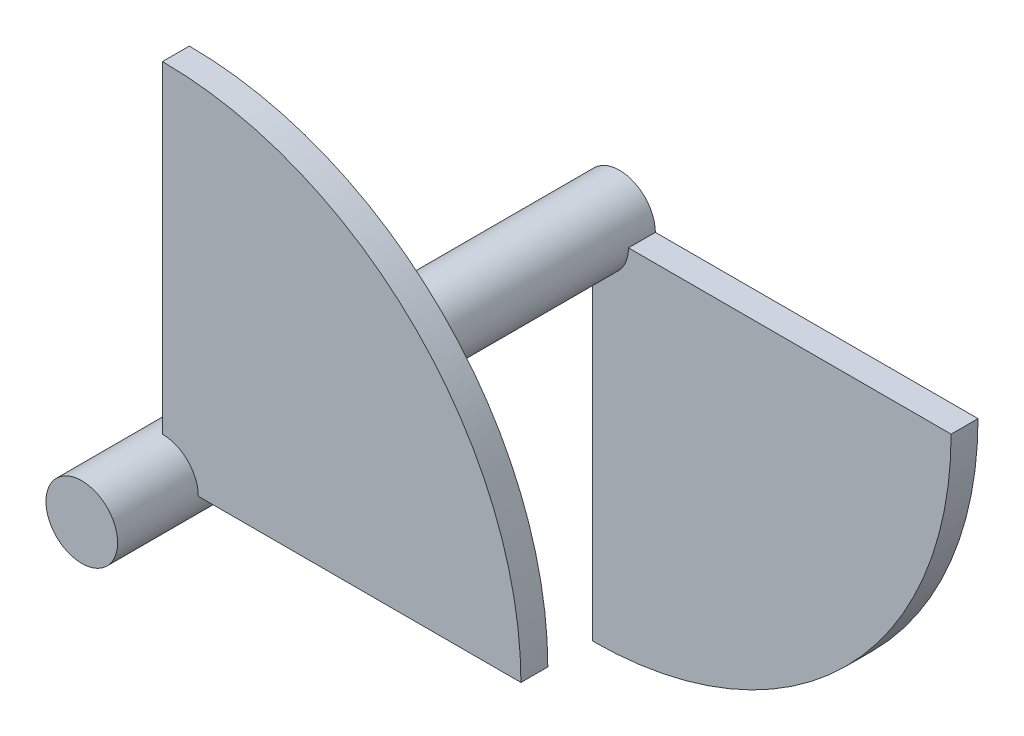
from build123d import *

# Parameters (mm, degrees)
SKETCH_1_R      = 4
EXTRUDE_1_DEPTH = 60
SKETCH_2_W      = 40
SKETCH_2_H      = 3
REVOLVE_1_ANGLE = 90
SKETCH_3_W      = 40
SKETCH_3_H      = 3
REVOLVE_2_ANGLE = 90


with BuildPart() as part:
    # 草图1 → 凸台-拉伸1 (new body)
    with BuildSketch(Plane.XY):
        Circle(SKETCH_1_R)
    extrude(amount=EXTRUDE_1_DEPTH)

    # 草图2 → 旋转1 (revolve)
    with BuildSketch(Plane(origin=(0, 0, 0), x_dir=(1, 0, 0), z_dir=(0, 1, 0))):
        with Locations((20, -49.5)):
            Rectangle(SKETCH_2_W, SKETCH_2_H)
    revolve(axis=Axis((0, 0, -2.761338376), (0, 0, 1)), revolution_arc=REVOLVE_1_ANGLE)

    # 草图3 → 旋转2 (revolve)
    with BuildSketch(Plane(origin=(0, 0, 0), x_dir=(1, 0, 0), z_dir=(0, 1, 0))):
        with Locations((20, -1.5)):
            Rectangle(SKETCH_3_W, SKETCH_3_H)
    revolve(axis=Axis((0, 0, -6.370265632), (0, 0, -1)), revolution_arc=REVOLVE_2_ANGLE)


solid = part.part
